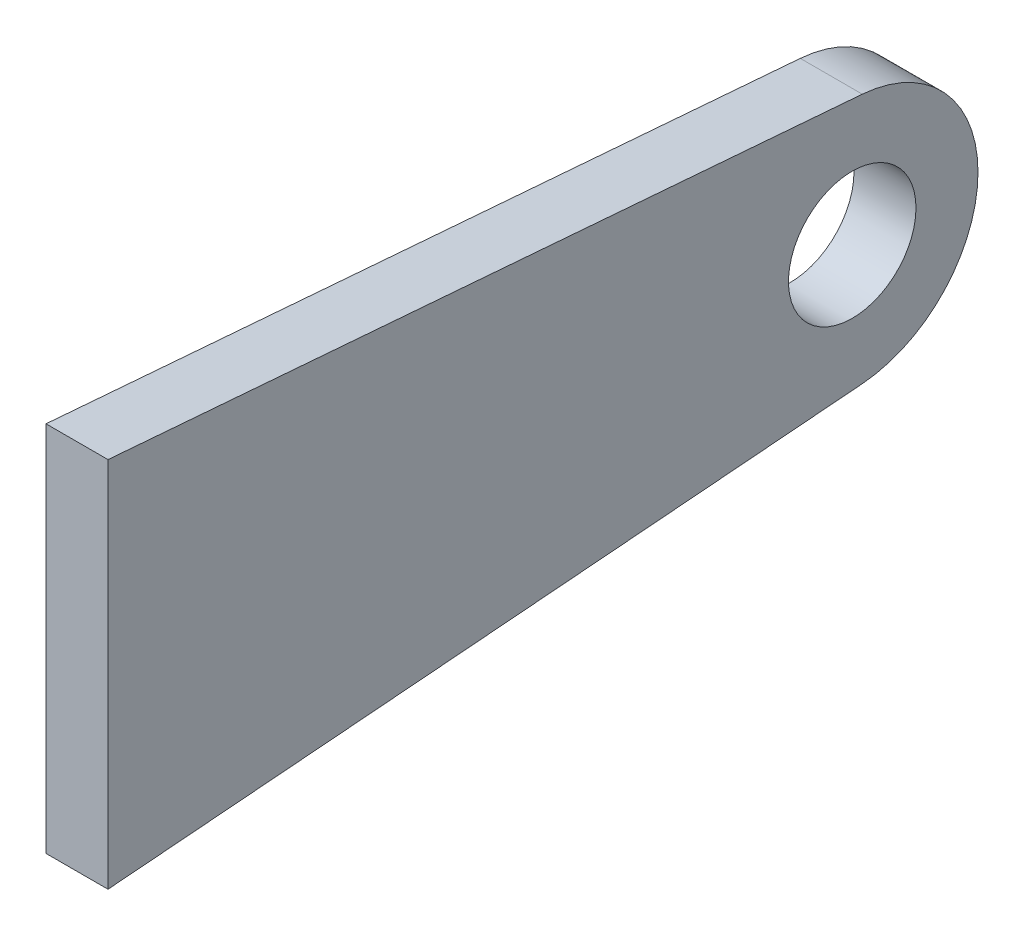
from build123d import *

# Parameters (mm, degrees)
SKETCH1_R           = 3.2639
BOSS_EXTRUDE1_DEPTH = 1.5875


with BuildPart() as part:
    # Sketch1 → Boss-Extrude1 (new, symmetric)
    with BuildSketch(Plane(origin=(0, 0, 0), x_dir=(0, 0, -1), z_dir=(1, 0, 0))):
        with BuildLine():
            Line((-38.1, 9.525), (-38.1, -9.525))
            Line((-38.1, -9.525), (0.516366314, -6.418161656))
            ThreePointArc((0.516366314, -6.418161656), (6.4389, 0), (0.516366314, 6.418161656))
            Line((0.516366314, 6.418161656), (-38.1, 9.525))
        make_face()
        Circle(SKETCH1_R, mode=Mode.SUBTRACT)
    extrude(amount=BOSS_EXTRUDE1_DEPTH, both=True)


solid = part.part
